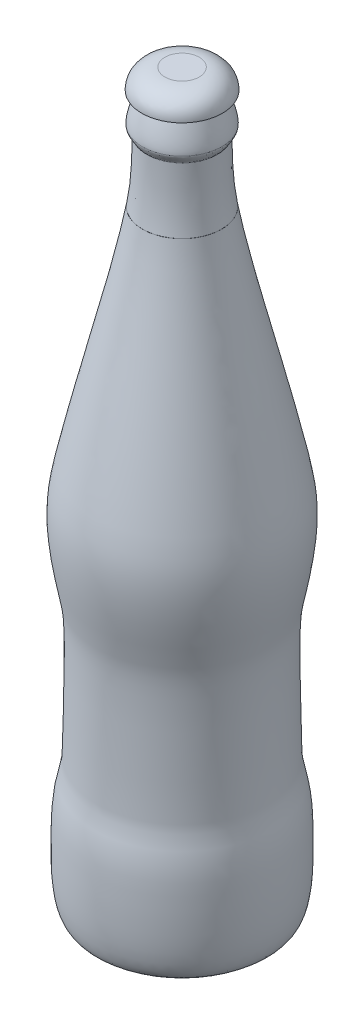
from build123d import *

# Parameters (mm, degrees)
ESBO_O4_R             = 0.5
CORTE_EXTRUS_O1_DEPTH = 0.4
ESBO_O5_R             = 12.574859085
CORTE_EXTRUS_O2_DEPTH = 0.01


with BuildPart() as part:
    # Esboço3 → Revolução1 (revolve)
    with BuildSketch(Plane.XY):
        with BuildLine():
            Line((98.872610789, 80.089195938), (100.700070966, 80.089195938))
            Line((100.700070966, 80.089195938), (100.700070966, 2.229411341))
            Line((100.700070966, 2.229411341), (92.180574198, 2.229411341))
            add(Edge.make_bspline(
                [(92.180574198, 2.229411341), (90.782969423, 2.229411341), (90.751426695, 8.991011182), (90.953581325, 13.277012687), (91.672621762, 15.743832178), (91.697315913, 20.033368714), (92.013516102, 28.682655638), (91.057467201, 33.741629067), (90.05029958, 38.647961647), (92.592577456, 50.712648916), (95.245091159, 60.43847554), (96.798771201, 68.72136512), (96.939514049, 71.16816865), (96.939514049, 73.902877998)],
                knots=[0, 0, 0, 0, 0.088023343, 0.127394592, 0.153536048, 0.168258283, 0.262799309, 0.291491474, 0.426487766, 0.4855964, 0.823469183, 0.879132953, 1, 1, 1, 1], degree=3))
            add(Edge.make_bspline(
                [(96.462790109, 74.871165581), (96.462790109, 74.559951165), (96.939514049, 74.030122187), (96.939514049, 73.902877998)],
                knots=[0, 0, 0, 0, 1, 1, 1, 1], degree=3))
            add(Edge.make_bspline(
                [(96.462790109, 74.871165581), (96.462790109, 75.69793324), (97.3026248, 77.972263506)],
                knots=[0, 0, 0, 1, 1, 1], degree=2))
            Line((97.3026248, 77.972263506), (96.4124057, 77.972263506))
            add(Edge.make_bspline(
                [(98.872610789, 80.089195938), (97.618426684, 80.089195938), (96.4124057, 79.352843268), (96.4124057, 77.972263506)],
                knots=[0, 0, 0, 0, 1, 1, 1, 1], degree=3))
        make_face()
    revolve(axis=Axis((100.700070966, 2.229411341, 0), (0, 1, 0)))

    # Esboço4 → Corte-extrusão1 (cut)
    with BuildSketch(Plane.XZ.offset(-2.229411341)):
        with Locations(Location((100.700070966, 0, 0), (0, 0, 270))):
            Circle(ESBO_O4_R)
    extrude(amount=-CORTE_EXTRUS_O1_DEPTH, mode=Mode.SUBTRACT)

    # Esboço5 → Corte-extrusão2 (cut)
    with BuildSketch(Plane(origin=(0, 67.229411341, 0), x_dir=(-1, 0, 0), z_dir=(0, -1, 0))):
        with Locations((-100.700070966, 0)):
            Circle(ESBO_O5_R)
    extrude(amount=-CORTE_EXTRUS_O2_DEPTH, mode=Mode.SUBTRACT)


with BuildPart() as corte_extrus_o2_piece_1:
    # of the separate pieces the step leaves, piece 1, a body of its own (corte_extrus_o2_pieces)
    add(part.part.solids().sort_by_distance((92.180574198, 2.229411341, 0))[0])


with BuildPart() as corte_extrus_o2_piece_2:
    # of the separate pieces the step leaves, piece 2, a body of its own (corte_extrus_o2_pieces)
    add(part.part.solids().sort_by_distance((98.872610789, 80.089195938, 0))[0])


solid = Compound([corte_extrus_o2_piece_1.part, corte_extrus_o2_piece_2.part])
